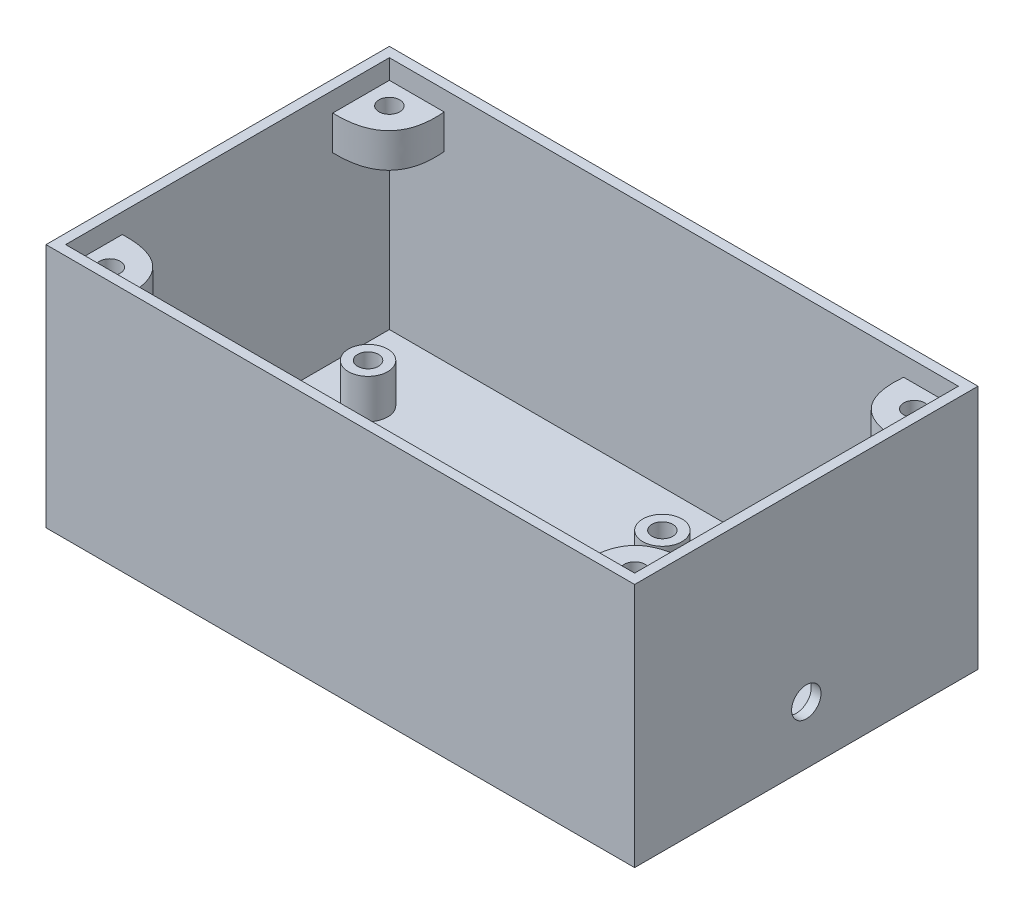
from build123d import *

# Parameters (mm, degrees)
SKETCH1_W           = 120
SKETCH1_H           = 70
BOSS_EXTRUDE1_DEPTH = 50
SKETCH4_W           = 116
SKETCH4_H           = 66
CUT_EXTRUDE1_DEPTH  = 48
SKETCH7_R           = 4
SKETCH7_R_2         = 2.125
BOSS_EXTRUDE3_DEPTH = 8
SKETCH9_R           = 3
CUT_EXTRUDE2_DEPTH  = 3
CUT_EXTRUDE3_START  = -3
SKETCH10_R          = 3
CUT_EXTRUDE3_DEPTH  = 3
BOSS_EXTRUDE4_DEPTH = 7
SKETCH13_R          = 2.125
CUT_EXTRUDE4_DEPTH  = 5


with BuildPart() as part:
    # Sketch1 → Boss-Extrude1 (new body)
    with BuildSketch(Plane(origin=(0, 0, 0), x_dir=(1, 0, 0), z_dir=(0, 1, 0))):
        Rectangle(SKETCH1_W, SKETCH1_H)
    extrude(amount=BOSS_EXTRUDE1_DEPTH)

    # Sketch4 → Cut-Extrude1 (cut)
    with BuildSketch(Plane(origin=(0, 50, 0), x_dir=(1, 0, 0), z_dir=(0, 1, 0))):
        Rectangle(SKETCH4_W, SKETCH4_H)
    extrude(amount=-CUT_EXTRUDE1_DEPTH, mode=Mode.SUBTRACT)

    # Sketch7 → Boss-Extrude3 (add)
    # profile 1 of 8: a face of its own
    with BuildSketch(Plane(origin=(0, 2, 0), x_dir=(1, 0, 0), z_dir=(0, 1, 0))):
        with Locations(Location((41.989163704, 23.984280939, 0), (0, 0, 270))):
            Circle(SKETCH7_R)
        with Locations(Location((41.989163704, 23.984280939, 0), (0, 0, 270))):
            Circle(SKETCH7_R_2, mode=Mode.SUBTRACT)
    # profile 2 of 8: a face of its own
    with BuildSketch(Plane(origin=(0, 2, 0), x_dir=(1, 0, 0), z_dir=(0, 1, 0))):
        with Locations(Location((27.989163704, 23.984280939, 0), (0, 0, 270))):
            Circle(SKETCH7_R)
        with Locations(Location((27.989163704, 23.984280939, 0), (0, 0, 270))):
            Circle(SKETCH7_R_2, mode=Mode.SUBTRACT)
    # profile 3 of 8: a face of its own
    with BuildSketch(Plane(origin=(0, 2, 0), x_dir=(1, 0, 0), z_dir=(0, 1, 0))):
        with Locations(Location((27.989163704, -25.015719061, 0), (0, 0, 270))):
            Circle(SKETCH7_R)
        with Locations(Location((27.989163704, -25.015719061, 0), (0, 0, 270))):
            Circle(SKETCH7_R_2, mode=Mode.SUBTRACT)
    # profile 4 of 8: a face of its own
    with BuildSketch(Plane(origin=(0, 2, 0), x_dir=(1, 0, 0), z_dir=(0, 1, 0))):
        with Locations(Location((41.989163704, -25.015719061, 0), (0, 0, 270))):
            Circle(SKETCH7_R)
        with Locations(Location((41.989163704, -25.015719061, 0), (0, 0, 270))):
            Circle(SKETCH7_R_2, mode=Mode.SUBTRACT)
    # profile 5 of 8: a face of its own
    with BuildSketch(Plane(origin=(0, 2, 0), x_dir=(1, 0, 0), z_dir=(0, 1, 0))):
        with Locations(Location((13.265207025, -17.861812849, 0), (0, 0, 270))):
            Circle(SKETCH7_R)
        with Locations(Location((13.265207025, -17.861812849, 0), (0, 0, 270))):
            Circle(SKETCH7_R_2, mode=Mode.SUBTRACT)
    # profile 6 of 8: a face of its own
    with BuildSketch(Plane(origin=(0, 2, 0), x_dir=(1, 0, 0), z_dir=(0, 1, 0))):
        with Locations(Location((13.265207025, 17.388187151, 0), (0, 0, 270))):
            Circle(SKETCH7_R)
        with Locations(Location((13.265207025, 17.388187151, 0), (0, 0, 270))):
            Circle(SKETCH7_R_2, mode=Mode.SUBTRACT)
    # profile 7 of 8: a face of its own
    with BuildSketch(Plane(origin=(0, 2, 0), x_dir=(1, 0, 0), z_dir=(0, 1, 0))):
        with Locations(Location((-46.734792975, 17.388187151, 0), (0, 0, 270))):
            Circle(SKETCH7_R)
        with Locations(Location((-46.734792975, 17.388187151, 0), (0, 0, 270))):
            Circle(SKETCH7_R_2, mode=Mode.SUBTRACT)
    # profile 8 of 8: a face of its own
    with BuildSketch(Plane(origin=(0, 2, 0), x_dir=(1, 0, 0), z_dir=(0, 1, 0))):
        with Locations(Location((-46.734792975, -17.861812849, 0), (0, 0, 270))):
            Circle(SKETCH7_R)
        with Locations(Location((-46.734792975, -17.861812849, 0), (0, 0, 270))):
            Circle(SKETCH7_R_2, mode=Mode.SUBTRACT)
    extrude(amount=BOSS_EXTRUDE3_DEPTH)

    # Sketch9 → Cut-Extrude2 (cut)
    with BuildSketch(Plane(origin=(60, 0, 0), x_dir=(0, 0, -1), z_dir=(1, 0, 0))):
        with Locations((0, 11.776029547)):
            Circle(SKETCH9_R)
    extrude(amount=-CUT_EXTRUDE2_DEPTH, mode=Mode.SUBTRACT)

    # Sketch10 → Cut-Extrude3 (cut)
    with BuildSketch(Plane.ZY.offset(60).offset(CUT_EXTRUDE3_START)):
        with Locations(Location((0, 11.776029547, 0), (0, 0, 180))):
            Circle(SKETCH10_R)
    extrude(amount=CUT_EXTRUDE3_DEPTH, mode=Mode.SUBTRACT)

    # Sketch12 → Boss-Extrude4 (add)
    with BuildSketch(Plane(origin=(0, 39, 0), x_dir=(1, 0, 0), z_dir=(0, 1, 0))):
        with BuildLine():
            Line((-46.836696193, -33), (-58, -33))
            Line((-58, -33), (-58, -21.439980772))
            add(Edge.make_bspline(
                [(-46.836696193, -33), (-45.747371945, -21.068063371), (-58, -21.439980772)],
                knots=[0, 0, 0, 1, 1, 1], degree=2))
        make_face()
        with BuildLine():
            Line((46.836696193, -33), (58, -33))
            Line((58, -33), (58, -21.439980772))
            add(Edge.make_bspline(
                [(46.836696193, -33), (45.747371945, -21.068063371), (58, -21.439980772)],
                knots=[0, 0, 0, 1, 1, 1], degree=2))
        make_face()
        with BuildLine():
            Line((58, 21.439980772), (58, 33))
            Line((58, 33), (46.836696193, 33))
            add(Edge.make_bspline(
                [(46.836696193, 33), (45.747371945, 21.068063371), (58, 21.439980772)],
                knots=[0, 0, 0, 1, 1, 1], degree=2))
        make_face()
        with BuildLine():
            Line((-46.836696193, 33), (-58, 33))
            Line((-58, 33), (-58, 21.439980772))
            add(Edge.make_bspline(
                [(-46.836696193, 33), (-45.747371945, 21.068063371), (-58, 21.439980772)],
                knots=[0, 0, 0, 1, 1, 1], degree=2))
        make_face()
    extrude(amount=BOSS_EXTRUDE4_DEPTH)

    # Sketch13 → Cut-Extrude4 (cut)
    with BuildSketch(Plane(origin=(0, 46, 0), x_dir=(1, 0, 0), z_dir=(0, 1, 0))):
        with Locations(Location((-53.5, -28.5, 0), (0, 0, 270))):
            Circle(SKETCH13_R)
        with Locations(Location((-53.5, 28.5, 0), (0, 0, 270))):
            Circle(SKETCH13_R)
        with Locations(Location((53.5, -28.5, 0), (0, 0, 270))):
            Circle(SKETCH13_R)
        with Locations(Location((53.5, 28.5, 0), (0, 0, 270))):
            Circle(SKETCH13_R)
    extrude(amount=-CUT_EXTRUDE4_DEPTH, mode=Mode.SUBTRACT)


solid = part.part
